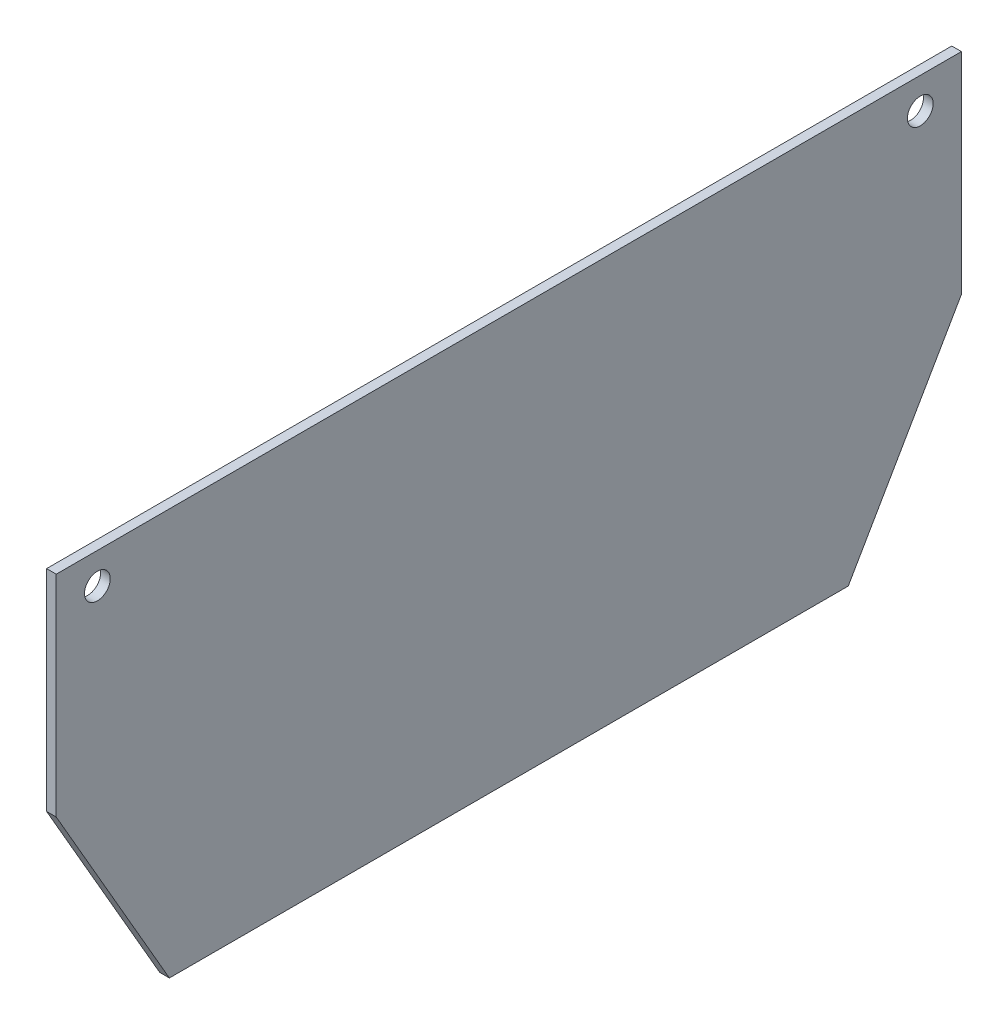
from build123d import *

# Parameters (mm, degrees)
SKETCH1_W           = 1117.6
SKETCH1_H           = 501.65
BOSS_EXTRUDE1_DEPTH = 11.90625
SKETCH3_R           = 15.875
CUT_EXTRUDE1_DEPTH  = 613.627439325
CHAMFER1_SIZE       = 139.7
CHAMFER1_SIZE2      = 241.967497817


with BuildPart() as part:
    # Sketch1 → Boss-Extrude1 (new body)
    with BuildSketch(Plane(origin=(0, 0, 0), x_dir=(0, 0, -1), z_dir=(1, 0, 0))):
        Rectangle(SKETCH1_W, SKETCH1_H)
    extrude(amount=BOSS_EXTRUDE1_DEPTH)

    # Sketch3 → Cut-Extrude1 (cut, through all)
    with BuildSketch(Plane(origin=(11.90625, 0, 0), x_dir=(0, 0, -1), z_dir=(1, 0, 0))):
        with Locations((-508, 212.725)):
            Circle(SKETCH3_R)
        with Locations((508, 212.725)):
            Circle(SKETCH3_R)
    extrude(amount=-CUT_EXTRUDE1_DEPTH, mode=Mode.SUBTRACT)

    # Chamfer1
    chamfer1_edges = [part.edges().sort_by_distance(p)[0] for p in [
        (5.953125, -250.825, -558.8),
        (5.953125, -250.825, 558.8),
    ]]
    chamfer1_side = [part.faces().sort_by_distance(p)[0] for p in [
        (5.953125, -250.825, 0),
    ]]
    chamfer(chamfer1_edges, length=CHAMFER1_SIZE, length2=CHAMFER1_SIZE2, reference=chamfer1_side[0])


solid = part.part
